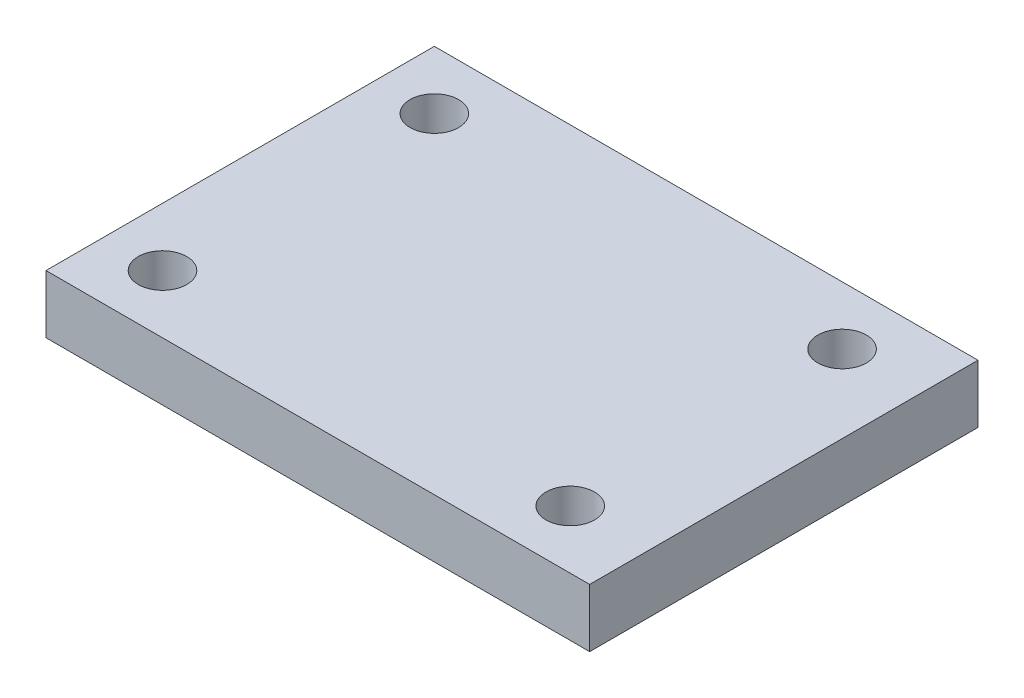
from build123d import *

# Parameters (mm, degrees)
SKETCH2_W           = 28
SKETCH2_H           = 20
BOSS_EXTRUDE1_DEPTH = 3
M3_TAPPED_HOLE1_D   = 2.5


with BuildPart() as part:
    # Sketch2 → Boss-Extrude1 (new body)
    with BuildSketch(Plane(origin=(0, 0, 0), x_dir=(1, 0, 0), z_dir=(0, 1, 0))):
        Rectangle(SKETCH2_W, SKETCH2_H)
    extrude(amount=BOSS_EXTRUDE1_DEPTH)

    # M3 Tapped Hole1 (through all)
    with Locations(Plane(origin=(0, 3, 0), x_dir=(1, 0, 0), z_dir=(0, 1, 0))):
        with Locations((-11, 7), (-11, -7), (10, -7), (10, 7)):
            Hole(M3_TAPPED_HOLE1_D / 2)


solid = part.part
